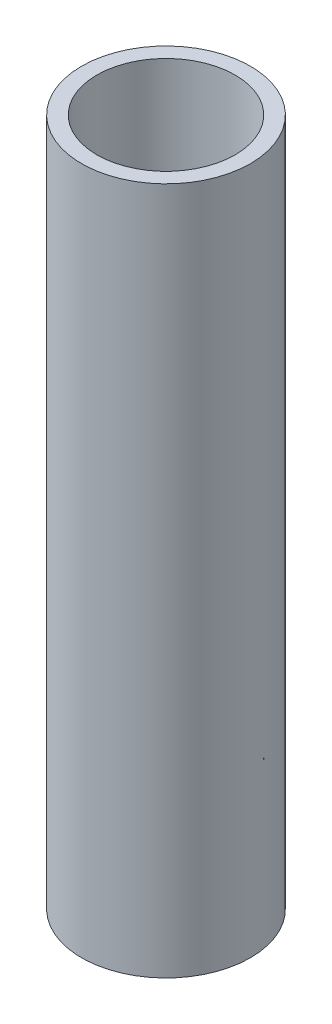
from build123d import *

# Parameters (mm, degrees)
SKETCH1_R           = 0.7366
SKETCH1_R_2         = 0.60325
BOSS_EXTRUDE1_DEPTH = 6


with BuildPart() as part:
    # Sketch1 → Boss-Extrude1 (new body)
    with BuildSketch(Plane.XZ.offset(-37.452667034)):
        with Locations(Location((0.7, -1.6, 0), (0, 0, 180))):
            Circle(SKETCH1_R)
        with Locations(Location((0.7, -1.6, 0), (0, 0, 180))):
            Circle(SKETCH1_R_2, mode=Mode.SUBTRACT)
    extrude(amount=BOSS_EXTRUDE1_DEPTH)


solid = part.part
